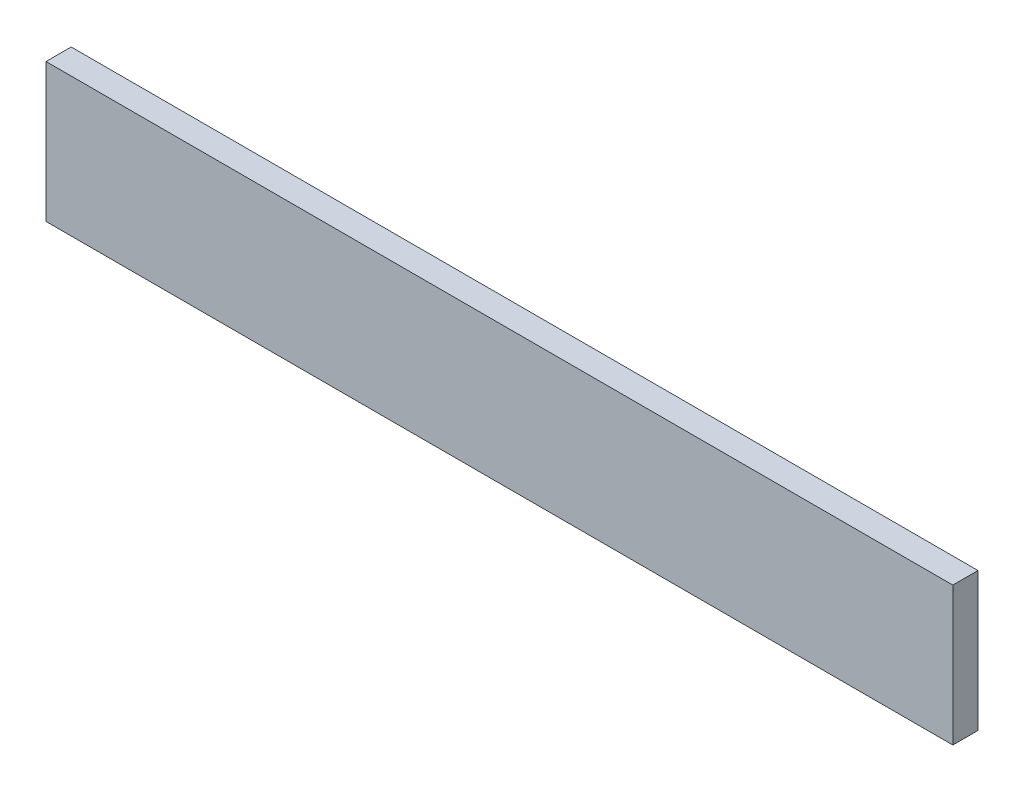
from build123d import *

# Parameters (mm, degrees)
SKETCH2_W           = 457.2
SKETCH2_H           = 69.85
BOSS_EXTRUDE1_DEPTH = 12.7


with BuildPart() as part:
    # Sketch2 → Boss-Extrude1 (new body)
    with BuildSketch(Plane.XY):
        Rectangle(SKETCH2_W, SKETCH2_H)
    extrude(amount=BOSS_EXTRUDE1_DEPTH)


solid = part.part
